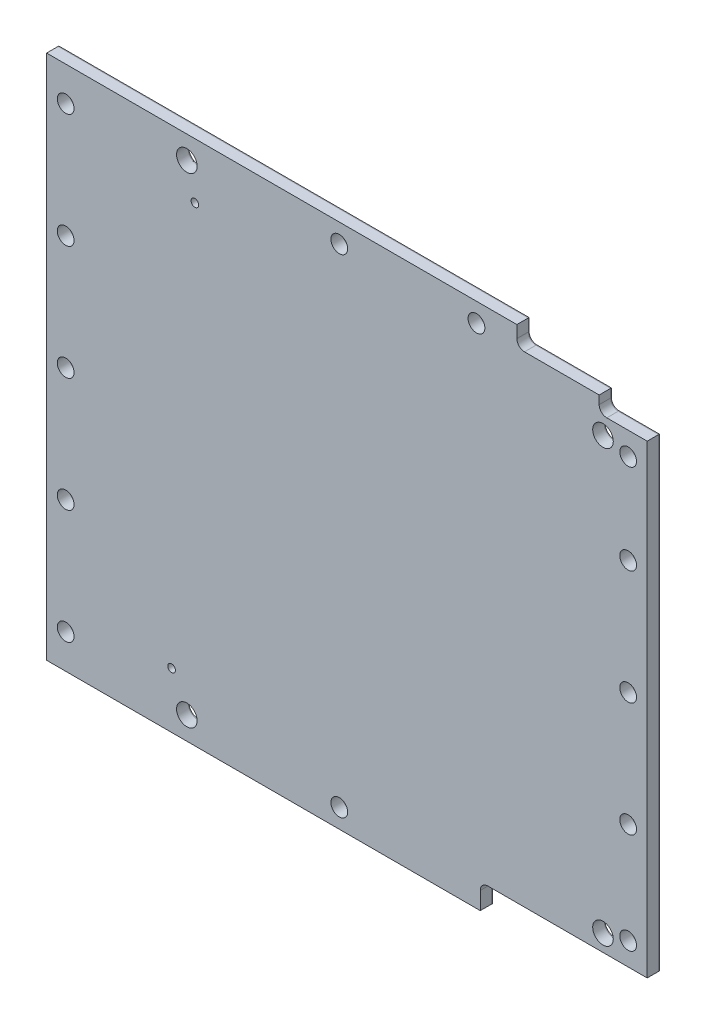
from build123d import *

# Parameters (mm, degrees)
SKETCH1_R                  = 1.1
BASE_EXTRUDE_DEPTH         = 1.6
M2_MTG_D                   = 2.2
M2_MTG_DEPTH               = 1.6
M2_MTG_TIP                 = 0.660946681
M2_5_CLEARANCE_HOLE1_D     = 2.7
M2_5_CLEARANCE_HOLE1_DEPTH = 1.6
M2_5_CLEARANCE_HOLE1_TIP   = 0.811161836
CONNECTOR_REF_D            = 1
KEEPOUT_W                  = 5
KEEPOUT_H                  = 61
KEEPOUT_H_2                = 69
CUT_EXTRUDE1_DEPTH         = 0.1
SKETCH11_R                 = 1.1
BOSS_EXTRUDE1_DEPTH        = 0.1
SKETCH11_W                 = 5
SKETCH11_H                 = 69
BOSS_EXTRUDE1_2_DEPTH      = 0.1
CUT_EXTRUDE2_START         = -0.1
CUT_EXTRUDE2_DEPTH         = 0.1
SKETCH12_R                 = 1.1
SKETCH12_R_2               = 1.35
BOSS_EXTRUDE2_DEPTH        = 0.1
BOSS_EXTRUDE2_2_DEPTH      = 0.1


with BuildPart() as part:
    # Sketch1 → BASE EXTRUDE (new body)
    with BuildSketch(Plane.XY):
        with BuildLine():
            Line((39.5, 0.3), (60.4, 0.3))
            Line((60.4, 0.3), (60.4, 61.3))
            Line((60.4, 61.3), (55.1, 61.3))
            ThreePointArc((55.1, 61.3), (54.392893219, 61.592893219), (54.1, 62.3))
            Line((54.1, 62.3), (54.1, 63.4))
            Line((54.1, 63.4), (44.3, 63.4))
            ThreePointArc((44.3, 63.4), (43.592893219, 63.692893219), (43.3, 64.4))
            Line((43.3, 64.4), (43.3, 66))
            Line((43.3, 66), (-18.4, 66))
            Line((-18.4, 66), (-18.4, -3))
            Line((-18.4, -3), (38.5, -3))
            Line((38.5, -3), (38.5, -0.7))
            ThreePointArc((38.5, -0.7), (38.792893219, 0.007106781), (39.5, 0.3))
        make_face()
        with Locations(Location((20, -0.5, 0), (0, 0, 180))):
            Circle(SKETCH1_R, mode=Mode.SUBTRACT)
    extrude(amount=-BASE_EXTRUDE_DEPTH)

    # M2 MTG
    with Locations(Plane(origin=(-15.9, 31.5, 0), x_dir=(1, 0, 0), z_dir=(0, 0, 1))):
        with Locations((0, 0), (0, -15), (0, -30), (0, 15), (0, 30), (35.9, 32), (53.9, 32), (73.8, 26.8), (73.8, 15), (73.8, 0), (73.8, -15), (73.8, -28.2), (35.9, -32)):
            Hole(M2_MTG_D / 2, depth=M2_MTG_DEPTH)
            with Locations((0, 0, -(M2_MTG_DEPTH + M2_MTG_TIP / 2))):  # 118° drill point
                Cone(0, M2_MTG_D / 2, M2_MTG_TIP, mode=Mode.SUBTRACT)

    # M2.5 Clearance Hole1
    with Locations(Plane(origin=(54.6, 2.5, 0), x_dir=(1, 0, 0), z_dir=(0, 0, 1))):
        with Locations((0, 0), (-54.6, -2.5), (-54.6, 60.5), (0, 56.55)):
            Hole(M2_5_CLEARANCE_HOLE1_D / 2, depth=M2_5_CLEARANCE_HOLE1_DEPTH)
            with Locations((0, 0, -(M2_5_CLEARANCE_HOLE1_DEPTH + M2_5_CLEARANCE_HOLE1_TIP / 2))):  # 118° drill point
                Cone(0, M2_5_CLEARANCE_HOLE1_D / 2, M2_5_CLEARANCE_HOLE1_TIP, mode=Mode.SUBTRACT)

    # CONNECTOR REF (through all)
    with Locations(Plane(origin=(0, 0, -1.6), x_dir=(-1, 0, 0), z_dir=(0, 0, -1))):
        with Locations((2, 4.3), (-1.05, 58.7)):
            Hole(CONNECTOR_REF_D / 2)

    # KEEPOUT → Cut-Extrude1 (cut)
    with BuildSketch(Plane(origin=(0, 0, -1.6), x_dir=(-1, 0, 0), z_dir=(0, 0, -1))):
        with Locations((-57.9, 30.8)):
            Rectangle(KEEPOUT_W, KEEPOUT_H)
        with Locations((15.9, 31.5)):
            Rectangle(KEEPOUT_W, KEEPOUT_H_2)
    extrude(amount=-CUT_EXTRUDE1_DEPTH, mode=Mode.SUBTRACT)

    # KEEPOUT OPT → Cut-Extrude2 (cut)
    with BuildSketch(Plane(origin=(0, 0, -1.6), x_dir=(-1, 0, 0), z_dir=(0, 0, -1)).offset(CUT_EXTRUDE2_START)):
        with BuildLine():
            Line((13.4, 61), (-52.4, 61))
            Line((-52.4, 61), (-52.4, 56.8))
            Line((-52.4, 56.8), (-55.4, 56.8))
            Line((-55.4, 56.8), (-55.4, 61.3))
            Line((-55.4, 61.3), (-55.1, 61.3))
            ThreePointArc((-55.1, 61.3), (-54.392893219, 61.592893219), (-54.1, 62.3))
            Line((-54.1, 62.3), (-54.1, 63.4))
            Line((-54.1, 63.4), (-44.3, 63.4))
            ThreePointArc((-44.3, 63.4), (-43.592893219, 63.692893219), (-43.3, 64.4))
            Line((-43.3, 64.4), (-43.3, 66))
            Line((-43.3, 66), (13.4, 66))
            Line((13.4, 66), (13.4, 61))
        make_face()
        with BuildLine():
            Line((13.4, -3), (-38.5, -3))
            Line((-38.5, -3), (-38.5, -0.7))
            ThreePointArc((-38.5, -0.7), (-38.792893219, 0.007106781), (-39.5, 0.3))
            Line((-39.5, 0.3), (-56.32595347, 0.3))
            Line((-56.32595347, 0.3), (-56.32595347, 4.75))
            Line((-56.32595347, 4.75), (-52.4, 4.75))
            Line((-52.4, 4.75), (-52.4, 2))
            Line((-52.4, 2), (13.4, 2))
            Line((13.4, 2), (13.4, -3))
        make_face()
    extrude(amount=CUT_EXTRUDE2_DEPTH, mode=Mode.SUBTRACT)


with BuildPart() as body_2:
    # Sketch11 → Boss-Extrude1 (new body)
    with BuildSketch(Plane(origin=(0, 0, -1.5), x_dir=(-1, 0, 0), z_dir=(0, 0, -1))):
        with BuildLine():
            Line((-55.4, 60.137428159), (-55.4, 61.3))
            Line((-55.4, 61.3), (-60.4, 61.3))
            Line((-60.4, 61.3), (-60.4, 0.3))
            Line((-60.4, 0.3), (-55.4, 0.3))
            Line((-55.4, 0.3), (-55.4, 1.412571841))
            ThreePointArc((-55.4, 1.412571841), (-55.95, 2.5), (-55.4, 3.587428159))
            Line((-55.4, 3.587428159), (-55.4, 57.962571841))
            ThreePointArc((-55.4, 57.962571841), (-55.95, 59.05), (-55.4, 60.137428159))
        make_face()
        with Locations((-57.9, 58.3)):
            Circle(SKETCH11_R, mode=Mode.SUBTRACT)
        with Locations((-57.9, 46.5)):
            Circle(SKETCH11_R, mode=Mode.SUBTRACT)
        with Locations((-57.9, 31.5)):
            Circle(SKETCH11_R, mode=Mode.SUBTRACT)
        with Locations((-57.9, 16.5)):
            Circle(SKETCH11_R, mode=Mode.SUBTRACT)
        with Locations((-57.9, 3.3)):
            Circle(SKETCH11_R, mode=Mode.SUBTRACT)
    extrude(amount=BOSS_EXTRUDE1_DEPTH)


with BuildPart() as body_3:
    # Sketch11 → Boss-Extrude1 2 (new body)
    with BuildSketch(Plane(origin=(0, 0, -1.5), x_dir=(-1, 0, 0), z_dir=(0, 0, -1))):
        with Locations((15.9, 31.5)):
            Rectangle(SKETCH11_W, SKETCH11_H)
        with Locations((15.9, 1.5)):
            Circle(SKETCH11_R, mode=Mode.SUBTRACT)
        with Locations((15.9, 16.5)):
            Circle(SKETCH11_R, mode=Mode.SUBTRACT)
        with Locations((15.9, 31.5)):
            Circle(SKETCH11_R, mode=Mode.SUBTRACT)
        with Locations((15.9, 46.5)):
            Circle(SKETCH11_R, mode=Mode.SUBTRACT)
        with Locations((15.9, 61.5)):
            Circle(SKETCH11_R, mode=Mode.SUBTRACT)
    extrude(amount=BOSS_EXTRUDE1_2_DEPTH)


with BuildPart() as body_4:
    # Sketch12 → Boss-Extrude2 (new body)
    with BuildSketch(Plane(origin=(0, 0, -1.5), x_dir=(-1, 0, 0), z_dir=(0, 0, -1))):
        with BuildLine():
            Line((-55.4, 61.3), (-55.4, 60.137428159))
            ThreePointArc((-55.4, 60.137428159), (-53.25, 59.05), (-55.4, 57.962571841))
            Line((-55.4, 57.962571841), (-55.4, 56.8))
            Line((-55.4, 56.8), (-52.4, 56.8))
            Line((-52.4, 56.8), (-52.4, 61))
            Line((-52.4, 61), (13.4, 61))
            Line((13.4, 61), (13.4, 66))
            Line((13.4, 66), (-43.3, 66))
            Line((-43.3, 66), (-43.3, 64.4))
            ThreePointArc((-43.3, 64.4), (-43.592893219, 63.692893219), (-44.3, 63.4))
            Line((-44.3, 63.4), (-54.1, 63.4))
            Line((-54.1, 63.4), (-54.1, 62.3))
            ThreePointArc((-54.1, 62.3), (-54.392893219, 61.592893219), (-55.1, 61.3))
            Line((-55.1, 61.3), (-55.4, 61.3))
        make_face()
        with Locations((-38, 63.5)):
            Circle(SKETCH12_R, mode=Mode.SUBTRACT)
        with Locations((-20, 63.5)):
            Circle(SKETCH12_R, mode=Mode.SUBTRACT)
        with Locations((0, 63)):
            Circle(SKETCH12_R_2, mode=Mode.SUBTRACT)
    extrude(amount=BOSS_EXTRUDE2_DEPTH)


with BuildPart() as body_5:
    # Sketch12 → Boss-Extrude2 2 (new body)
    with BuildSketch(Plane(origin=(0, 0, -1.5), x_dir=(-1, 0, 0), z_dir=(0, 0, -1))):
        with BuildLine():
            Line((-52.4, 2), (-52.4, 4.75))
            Line((-52.4, 4.75), (-55.4, 4.75))
            Line((-55.4, 4.75), (-55.4, 3.587428159))
            ThreePointArc((-55.4, 3.587428159), (-53.25, 2.5), (-55.4, 1.412571841))
            Line((-55.4, 1.412571841), (-55.4, 0.3))
            Line((-55.4, 0.3), (-39.5, 0.3))
            ThreePointArc((-39.5, 0.3), (-38.792893219, 0.007106781), (-38.5, -0.7))
            Line((-38.5, -0.7), (-38.5, -3))
            Line((-38.5, -3), (13.4, -3))
            Line((13.4, -3), (13.4, 2))
            Line((13.4, 2), (-52.4, 2))
        make_face()
        with Locations((-20, -0.5)):
            Circle(SKETCH12_R, mode=Mode.SUBTRACT)
        Circle(SKETCH12_R_2, mode=Mode.SUBTRACT)
    extrude(amount=BOSS_EXTRUDE2_2_DEPTH)


solid = Compound([part.part, body_2.part, body_3.part, body_4.part, body_5.part])
